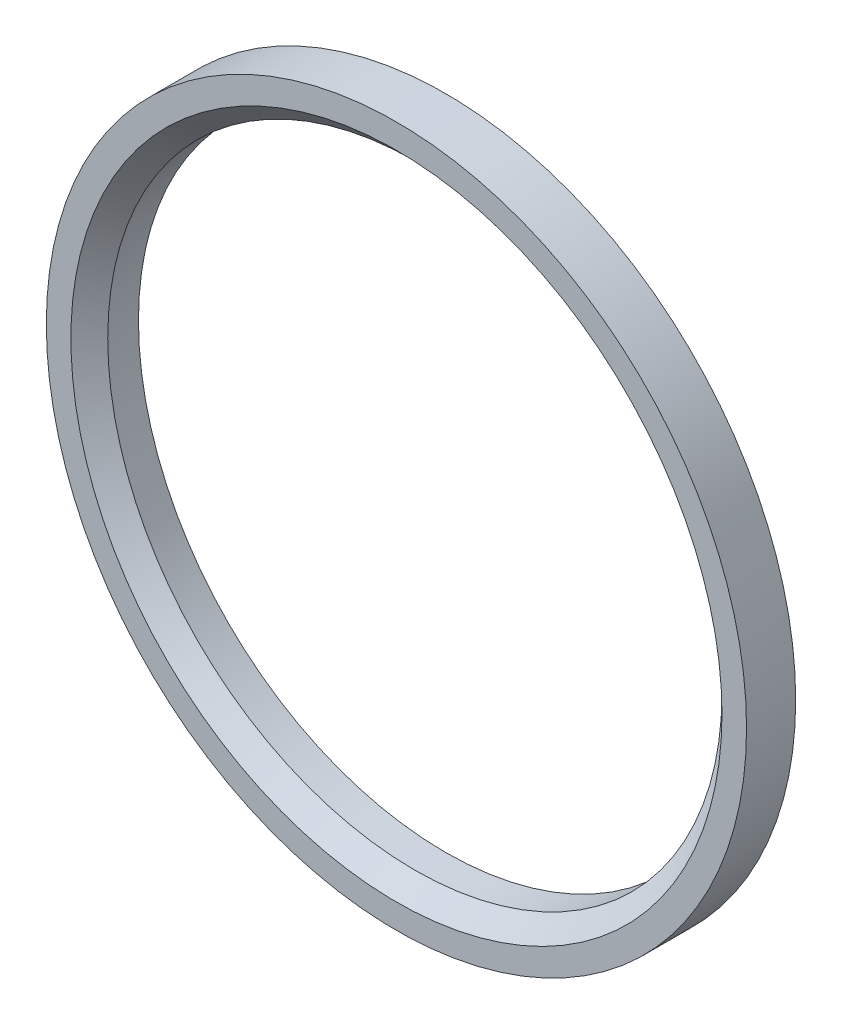
from build123d import *

# Parameters (mm, degrees)
SZKIC2_R                    = 28.5
SZKIC2_R_2                  = 25
DODANIE_WYCI_GNI_CIE2_DEPTH = 2
SFAZOWANIE1_SIZE            = 1.5


with BuildPart() as part:
    # Szkic2 → Dodanie-wyciągnięcie2 (new, symmetric)
    with BuildSketch(Plane.XY):
        Circle(SZKIC2_R)
        Circle(SZKIC2_R_2, mode=Mode.SUBTRACT)
    extrude(amount=DODANIE_WYCI_GNI_CIE2_DEPTH, both=True)

    # Sfazowanie1
    sfazowanie1_edges = [part.edges().sort_by_distance(p)[0] for p in [
        (-25, 0, 2),
    ]]
    chamfer(sfazowanie1_edges, length=SFAZOWANIE1_SIZE)


solid = part.part
